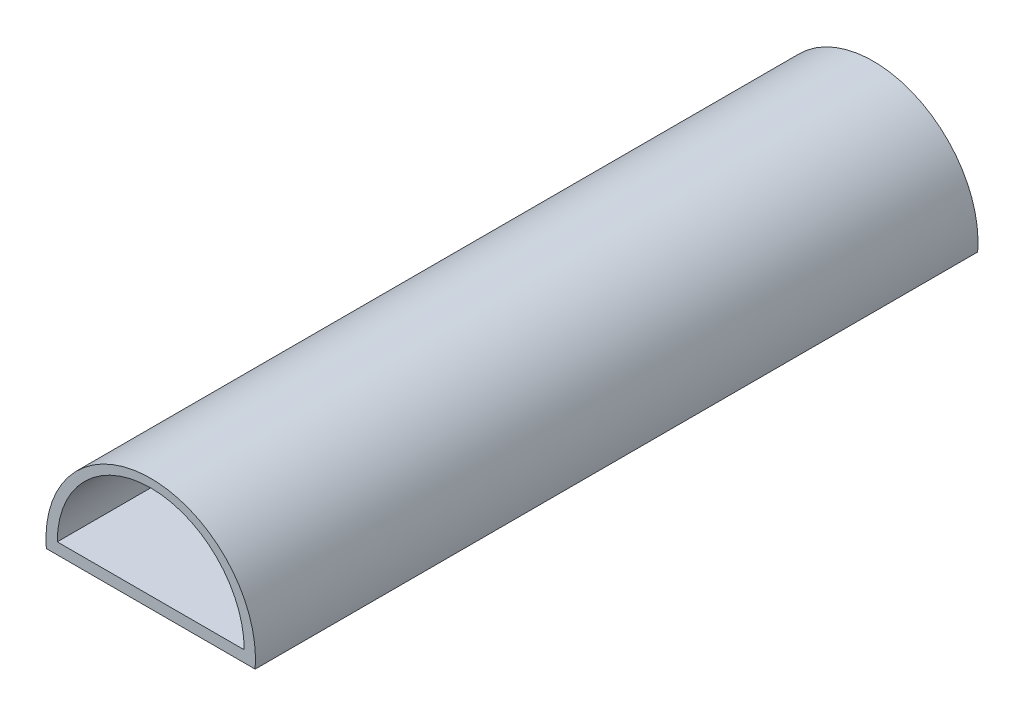
from build123d import *

# Parameters (mm, degrees)
BOSS_EXTRUDE2_DEPTH = 101.6


with BuildPart() as part:
    # Sketch1 → Boss-Extrude2 (new body)
    with BuildSketch(Plane.XY):
        with BuildLine():
            Line((-23.111377793, -10.048425127), (6.257372207, -10.048425127))
            ThreePointArc((6.257372207, -10.048425127), (-8.427002793, 5.85418124), (-23.111377793, -10.048425127))
        make_face()
        with BuildLine():
            Line((-8.427002793, -8.460925127), (-21.571502793, -8.460925127))
            ThreePointArc((-21.571502793, -8.460925127), (-8.427002793, 4.683574873), (4.717497207, -8.460925127))
            Line((4.717497207, -8.460925127), (-8.427002793, -8.460925127))
        make_face(mode=Mode.SUBTRACT)
    extrude(amount=BOSS_EXTRUDE2_DEPTH)


solid = part.part
